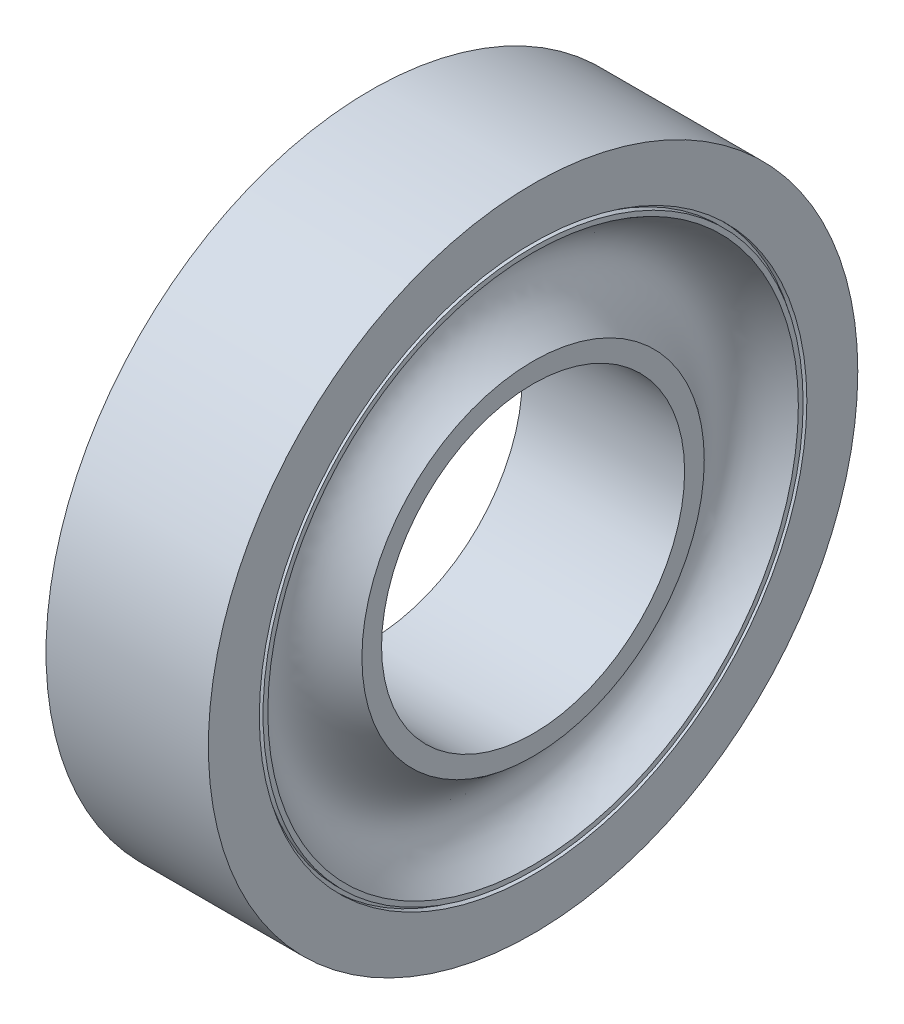
from build123d import *


with BuildPart() as part:
    # Sketch1 → Revolve1 (revolve)
    with BuildSketch(Plane.XY, mode=Mode.PRIVATE) as revolve1_sk:
        with BuildLine():
            Line((7.5, 14), (-7.5, 14))
            Line((-7.5, 14), (-7.5, 15.815032431))
            add(Edge.make_bspline(
                [(-7.5, 15.815032431), (-0.221533759, 20.854783747), (-7.5, 24.507708918)],
                knots=[0, 0, 0, 1, 1, 1], degree=2))
            Line((-7.5, 24.507708918), (-7.5, 24.950271606))
            Line((-7.5, 24.950271606), (-6.958076182, 24.950271606))
            Line((-6.958076182, 24.950271606), (-6.958076182, 25.292900784))
            Line((-6.958076182, 25.292900784), (-7.5, 25.292900784))
            Line((-7.5, 25.292900784), (-7.5, 30))
            Line((-7.5, 30), (7.5, 30))
            Line((7.5, 30), (7.5, 25.292900784))
            Line((7.5, 25.292900784), (6.958076182, 25.292900784))
            Line((6.958076182, 25.292900784), (6.958076182, 24.950271606))
            Line((6.958076182, 24.950271606), (7.5, 24.950271606))
            Line((7.5, 24.950271606), (7.5, 24.507708918))
            add(Edge.make_bspline(
                [(7.5, 15.815032431), (0.221533759, 20.854783747), (7.5, 24.507708918)],
                knots=[0, 0, 0, 1, 1, 1], degree=2))
            Line((7.5, 15.815032431), (7.5, 14))
        make_face()
    revolve(revolve1_sk.sketch.rotate(Axis((37.422784058, 0, 0), (-1, 0, 0)), 90), axis=Axis((37.422784058, 0, 0), (-1, 0, 0)))


solid = part.part
